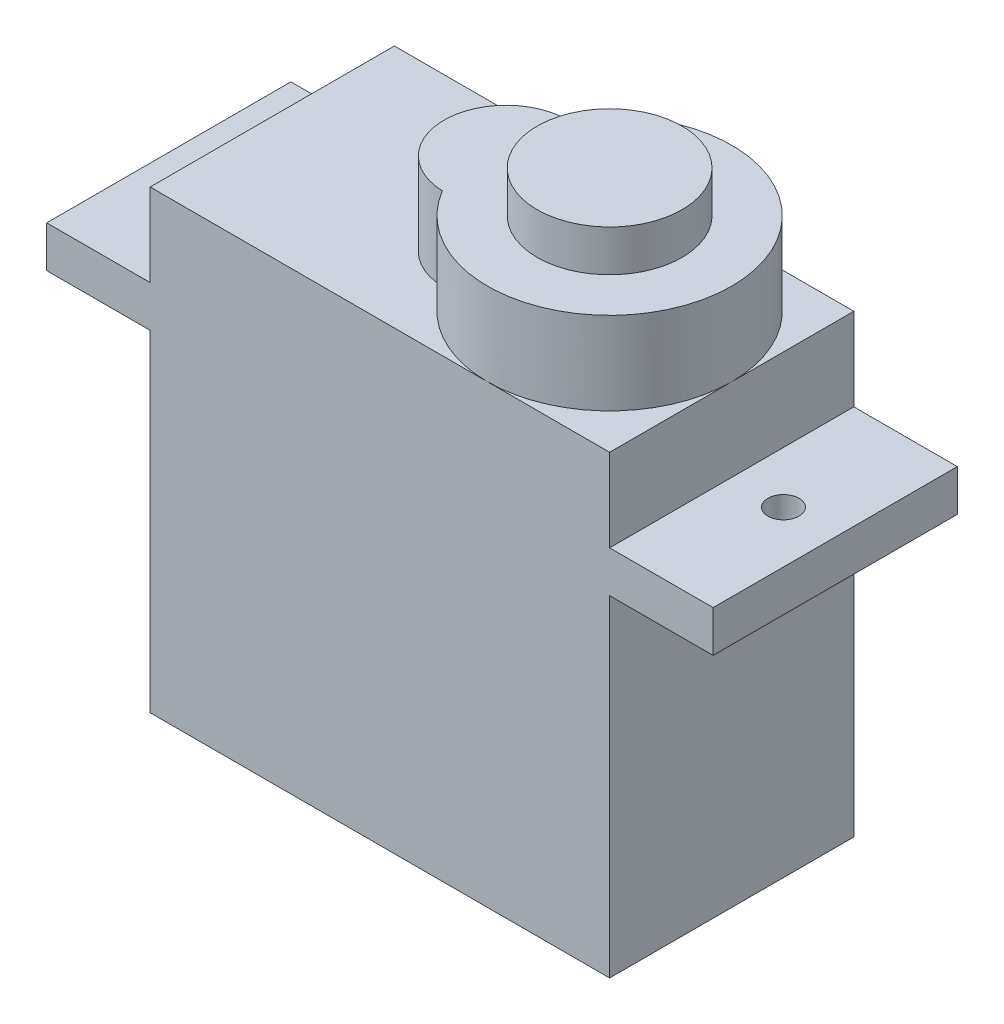
from build123d import *

# Parameters (mm, degrees)
SKETCH1_W           = 22.2
SKETCH1_H           = 11.8
BOSS_EXTRUDE1_DEPTH = 22
SKETCH2_W           = 5
SKETCH2_H           = 2
BOSS_EXTRUDE2_DEPTH = 11.8
BOSS_EXTRUDE3_DEPTH = 4
SKETCH5_R           = 3.5
BOSS_EXTRUDE5_DEPTH = 2
SKETCH6_R           = 0.75
CUT_EXTRUDE2_DEPTH  = 2


with BuildPart() as part:
    # Sketch1 → Boss-Extrude1 (new body)
    with BuildSketch(Plane(origin=(0, 0, 0), x_dir=(1, 0, 0), z_dir=(0, 1, 0))):
        Rectangle(SKETCH1_W, SKETCH1_H)
    extrude(amount=-BOSS_EXTRUDE1_DEPTH)

    # Sketch2 → Boss-Extrude2 (add)
    with BuildSketch(Plane.XY.offset(5.9)):
        with Locations((13.6, -5)):
            Rectangle(SKETCH2_W, SKETCH2_H)
        with Locations((-13.6, -5)):
            Rectangle(SKETCH2_W, SKETCH2_H)
    extrude(amount=-BOSS_EXTRUDE2_DEPTH)

    # Sketch4 → Boss-Extrude3 (add)
    with BuildSketch(Plane(origin=(0, 0, 0), x_dir=(1, 0, 0), z_dir=(0, 1, 0))):
        with BuildLine():
            ThreePointArc((0.119, -2.998906301), (11.1, 0), (0.119, 2.998906301))
            ThreePointArc((0.119, 2.998906301), (-2.8, 0), (0.119, -2.998906301))
        make_face()
    extrude(amount=BOSS_EXTRUDE3_DEPTH)

    # Sketch5 → Boss-Extrude5 (add)
    with BuildSketch(Plane(origin=(0, 4, 0), x_dir=(1, 0, 0), z_dir=(0, 1, 0))):
        with Locations(Location((5.2, 0, 0), (0, 0, 270))):
            Circle(SKETCH5_R)
    extrude(amount=BOSS_EXTRUDE5_DEPTH)

    # Sketch6 → Cut-Extrude2 (cut)
    with BuildSketch(Plane(origin=(0, -4, 0), x_dir=(1, 0, 0), z_dir=(0, 1, 0))):
        with Locations(Location((-13.6, 0, 0), (0, 0, 270))):
            Circle(SKETCH6_R)
        with Locations(Location((13.6, 0, 0), (0, 0, 270))):
            Circle(SKETCH6_R)
    extrude(amount=-CUT_EXTRUDE2_DEPTH, mode=Mode.SUBTRACT)


solid = part.part
